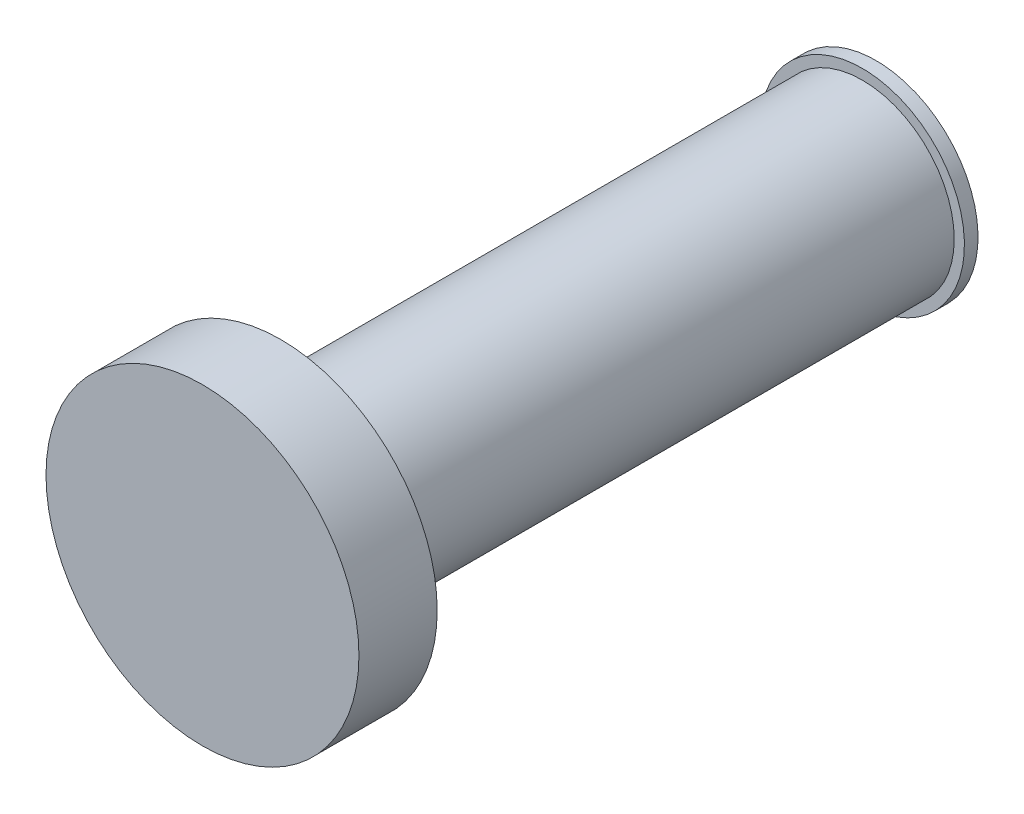
from build123d import *

# Parameters (mm, degrees)
SKETCH1_R           = 1.35
BOSS_EXTRUDE1_DEPTH = 4.275
SKETCH2_R           = 2.3
BOSS_EXTRUDE2_DEPTH = 1.15
SKETCH3_R           = 1.5
BOSS_EXTRUDE3_DEPTH = 1.15


with BuildPart() as part:
    # Sketch1 → Boss-Extrude1 (new, symmetric)
    with BuildSketch(Plane.XY):
        Circle(SKETCH1_R)
    extrude(amount=BOSS_EXTRUDE1_DEPTH, both=True)

    # Sketch2 → Boss-Extrude2 (add)
    with BuildSketch(Plane.XY.offset(4.275)):
        with Locations((0, 0.024044425)):
            Circle(SKETCH2_R)
    extrude(amount=BOSS_EXTRUDE2_DEPTH)

    # Sketch3 → Boss-Extrude3 (add)
    with BuildSketch(Plane(origin=(0, 0, -4.275), x_dir=(-1, 0, 0), z_dir=(0, 0, -1))):
        Circle(SKETCH3_R)
    extrude(amount=BOSS_EXTRUDE3_DEPTH)

    # Sketch4 → Cut-Revolve1 (revolve, cut)
    with BuildSketch(Plane(origin=(0, 0, 0), x_dir=(0, 0, -1), z_dir=(1, 0, 0)), mode=Mode.PRIVATE) as cut_revolve1_sk:
        Polygon((5.225, 0.2), (5.225, 0), (5.425, 0), (5.425, 1.5), (4.475, 1.5), align=None)
    revolve(cut_revolve1_sk.sketch.rotate(Axis((0, 0, -4.275), (0, 0, -1)), 180), axis=Axis((0, 0, -4.275), (0, 0, -1)), mode=Mode.SUBTRACT)


solid = part.part
